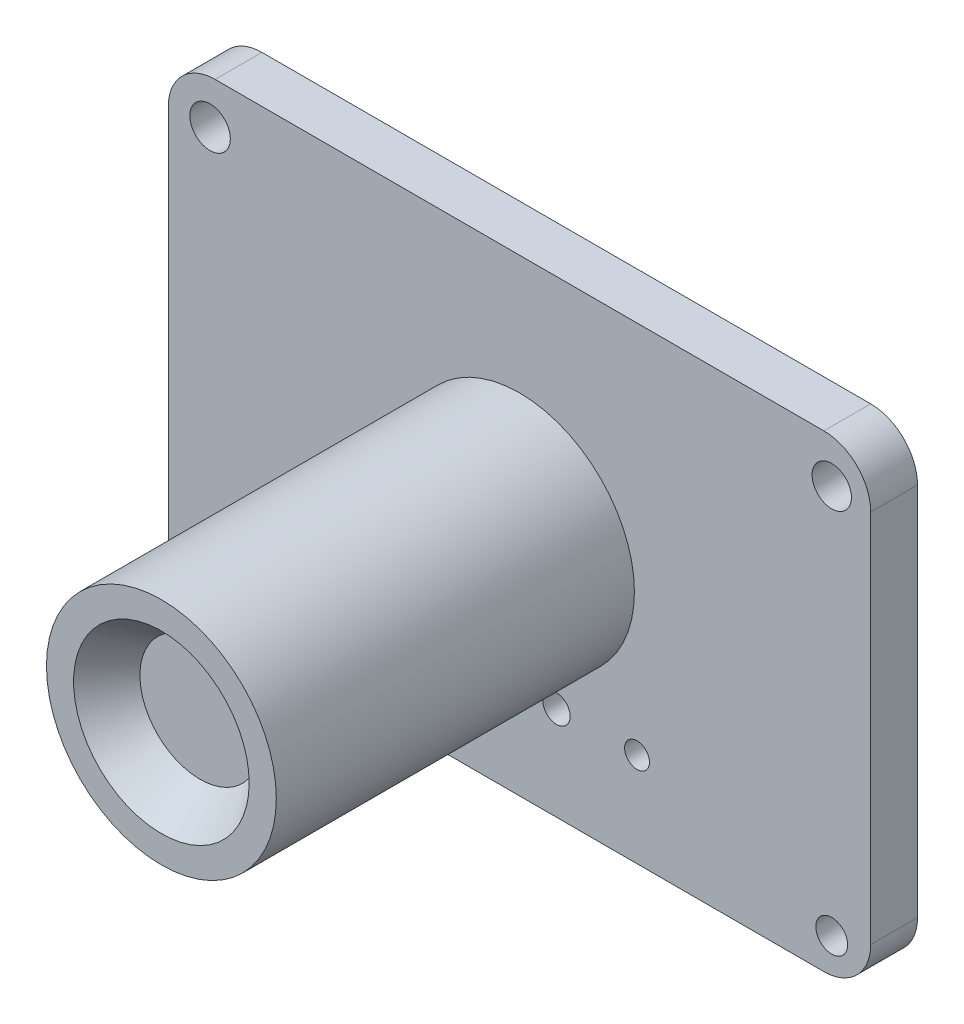
from build123d import *

# Parameters (mm, degrees)
BOSS_EXTRUDE1_DEPTH = 1
SKETCH2_R           = 0.432128273
SKETCH2_R_2         = 0.419941145
SKETCH2_R_3         = 0.339655263
SKETCH2_R_4         = 0.411394619
SKETCH2_R_5         = 0.305784332
SKETCH2_R_6         = 0.294014574
SKETCH2_R_7         = 0.29238352
SKETCH2_R_8         = 0.265611248
CUT_EXTRUDE1_DEPTH  = 1
SKETCH2_5_R         = 2.453911785
BOSS_EXTRUDE2_DEPTH = 4


with BuildPart() as part:
    # Sketch1 → Boss-Extrude1 (new body)
    with BuildSketch(Plane.XY):
        with BuildLine():
            Line((-6.5, -5), (6.5, -5))
            ThreePointArc((6.5, -5), (7.207106781, -4.707106781), (7.5, -4))
            Line((7.5, -4), (7.5, 4))
            ThreePointArc((7.5, 4), (7.207106781, 4.707106781), (6.5, 5))
            Line((6.5, 5), (-6.5, 5))
            ThreePointArc((-6.5, 5), (-7.207106781, 4.707106781), (-7.5, 4))
            Line((-7.5, 4), (-7.5, -4))
            ThreePointArc((-7.5, -4), (-7.207106781, -4.707106781), (-6.5, -5))
        make_face()
    extrude(amount=BOSS_EXTRUDE1_DEPTH)

    # Sketch2 → Cut-Extrude1 (cut)
    with BuildSketch(Plane.XY.offset(1)):
        with Locations((-6.6069869, 4.061679043)):
            Circle(SKETCH2_R)
        with Locations((6.667725288, 4.061679043)):
            Circle(SKETCH2_R_2)
        with Locations((6.667725288, -4.252731437)):
            Circle(SKETCH2_R_3)
        with Locations((-6.6069869, -4.252731437)):
            Circle(SKETCH2_R_4)
        with Locations((-2.739976181, -3.037963672)):
            Circle(SKETCH2_R_5)
        with Locations((-0.911075824, -2.990722704)):
            Circle(SKETCH2_R_6)
        with Locations((0.789599047, -2.990722704)):
            Circle(SKETCH2_R_7)
        with Locations((2.510520048, -2.990722704)):
            Circle(SKETCH2_R_8)
    extrude(amount=-CUT_EXTRUDE1_DEPTH, mode=Mode.SUBTRACT)

    # Sketch2<5> → Boss-Extrude2 (add)
    with BuildSketch(Plane.XY.offset(1)):
        Circle(SKETCH2_5_R)
    extrude(amount=BOSS_EXTRUDE2_DEPTH)

    # Sketch6 → Revolve1 (revolve)
    with BuildSketch(Plane(origin=(0, 0, 0), x_dir=(0, 0, -1), z_dir=(1, 0, 0))):
        Polygon((-5, 2.453911785), (-8.647016012, 2.453911785), (-8.647016012, 1.874818049), (-7.823508006, 1.280931587), (-7.823508006, 0), (-5, 0), align=None)
    revolve(axis=Axis((0, 0, 7.823508006), (0, 0, -1)))


solid = part.part
